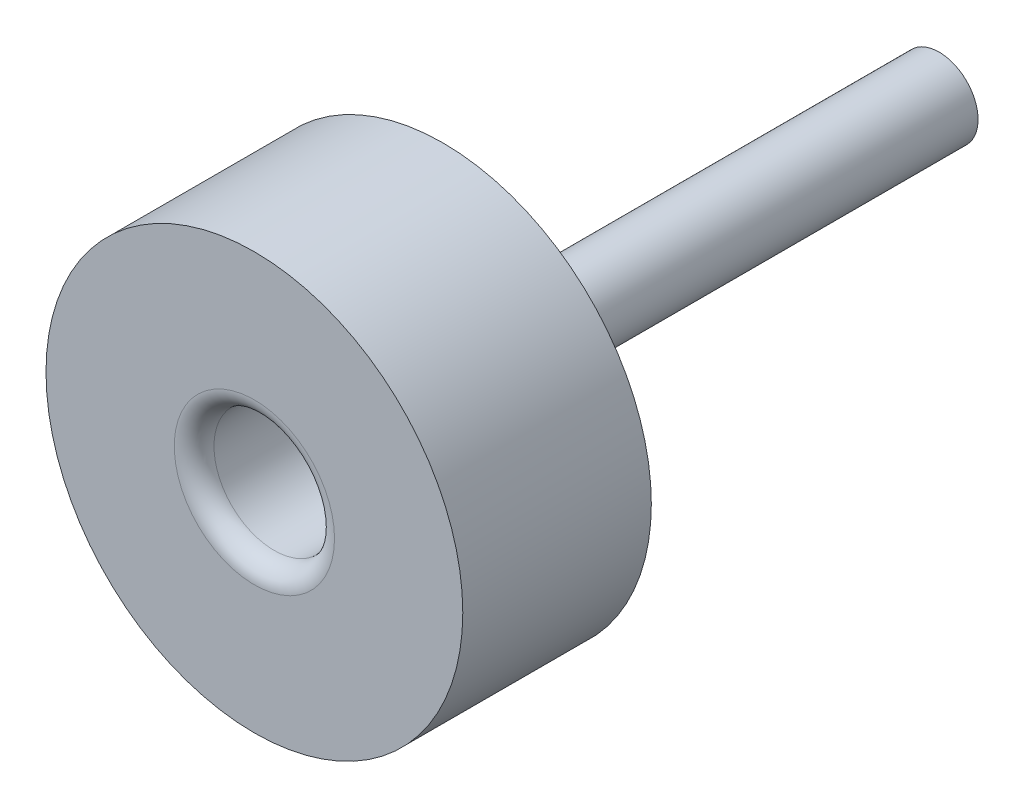
from build123d import *

# Parameters (mm, degrees)
SKIZZE1_R                       = 6
AUFSATZ_LINEAR_AUSTRAGEN1_DEPTH = 9
SKIZZE2_R                       = 3.925
AUFSATZ_LINEAR_AUSTRAGEN2_DEPTH = 41
SKIZZE3_R                       = 21
AUFSATZ_LINEAR_AUSTRAGEN3_DEPTH = 19
SKIZZE4_R                       = 6.075
SCHNITT_LINEAR_AUSTRAGEN2_DEPTH = 10
VERRUNDUNG1_R                   = 2
SKIZZE5_R                       = 1.5
SCHNITT_LINEAR_AUSTRAGEN3_DEPTH = 15


with BuildPart() as part:
    # Skizze1 → Aufsatz-Linear austragen1 (new body)
    with BuildSketch(Plane.XY):
        Circle(SKIZZE1_R)
    extrude(amount=AUFSATZ_LINEAR_AUSTRAGEN1_DEPTH)

    # Skizze2 → Aufsatz-Linear austragen2 (add)
    with BuildSketch(Plane(origin=(0, 0, 0), x_dir=(-1, 0, 0), z_dir=(0, 0, -1))):
        Circle(SKIZZE2_R)
    extrude(amount=AUFSATZ_LINEAR_AUSTRAGEN2_DEPTH)

    # Skizze3 → Aufsatz-Linear austragen3 (add)
    with BuildSketch(Plane.XY.offset(9)):
        Circle(SKIZZE3_R)
    extrude(amount=AUFSATZ_LINEAR_AUSTRAGEN3_DEPTH)

    # Skizze4 → Schnitt-Linear austragen2 (cut)
    with BuildSketch(Plane.XY.offset(28)):
        Circle(SKIZZE4_R)
    extrude(amount=-SCHNITT_LINEAR_AUSTRAGEN2_DEPTH, mode=Mode.SUBTRACT)

    # Verrundung1
    verrundung1_edges = [part.edges().sort_by_distance(p)[0] for p in [
        (-6.075, 0, 28),
    ]]
    fillet(verrundung1_edges, radius=VERRUNDUNG1_R)

    # Skizze5 → Schnitt-Linear austragen3 (cut)
    with BuildSketch(Plane(origin=(0, 0, -41), x_dir=(-1, 0, 0), z_dir=(0, 0, -1))):
        Circle(SKIZZE5_R)
    extrude(amount=-SCHNITT_LINEAR_AUSTRAGEN3_DEPTH, mode=Mode.SUBTRACT)


solid = part.part
